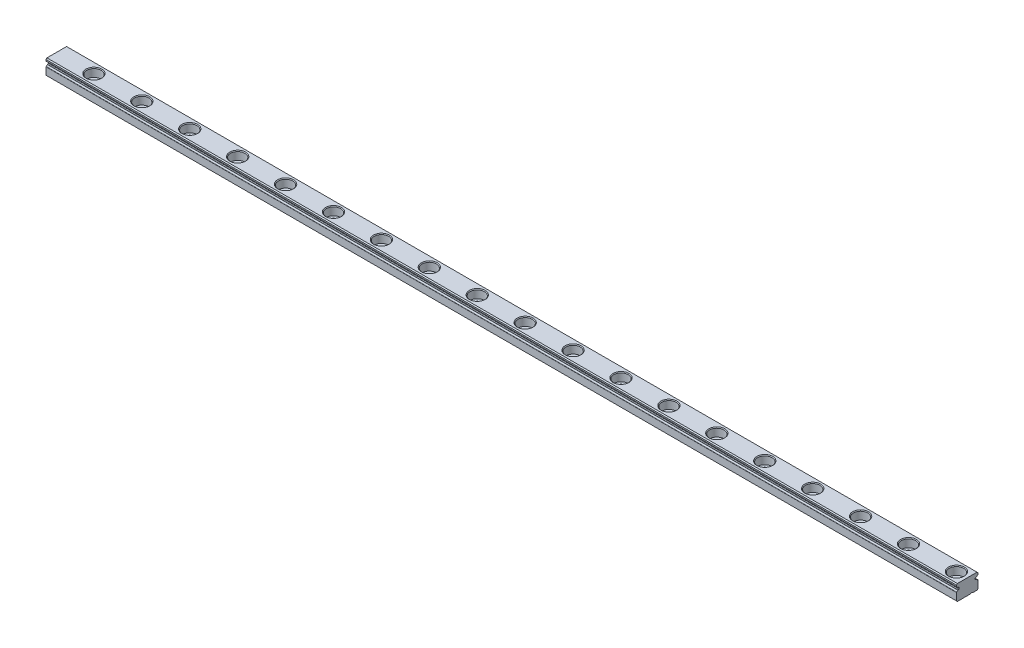
from build123d import *

# Parameters (mm, degrees)
EXTRUDE_1_DEPTH            = 190
PATTERN_LINEAR_1_COUNT     = 11
PATTERN_LINEAR_1_PITCH     = 20
PATTERN_LINEAR_1_COL_COUNT = 9
PATTERN_LINEAR_1_COL_PITCH = 20


with BuildPart() as part:
    # 草图1 → 凸台-拉伸1 (new, symmetric)
    with BuildSketch(Plane(origin=(0, 0, 0), x_dir=(0, 0, -1), z_dir=(1, 0, 0))):
        with BuildLine():
            Line((-4.5, 6.099989694), (-4.5, 5.5583))
            ThreePointArc((-4.5, 5.5583), (-4.475010695, 5.475400506), (-4.408368985, 5.420122355))
            ThreePointArc((-4.408368985, 5.420122355), (-4.141124334, 5.252255308), (-3.93950231, 5.009464023))
            ThreePointArc((-3.93950231, 5.009464023), (-3.898814145, 4.964704671), (-3.843755349, 4.939655613))
            Line((-3.843755349, 4.939655613), (-3.466644651, 4.853644387))
            ThreePointArc((-3.466644651, 4.853644387), (-3.382732565, 4.800932608), (-3.35, 4.7074))
            Line((-3.35, 4.7074), (-3.35, 4.2926))
            ThreePointArc((-3.35, 4.2926), (-3.382732565, 4.199067392), (-3.466644651, 4.146355613))
            Line((-3.466644651, 4.146355613), (-3.843755349, 4.060344387))
            ThreePointArc((-3.843755349, 4.060344387), (-3.898814145, 4.035295329), (-3.93950231, 3.990535977))
            ThreePointArc((-3.93950231, 3.990535977), (-4.141123452, 3.74774336), (-4.408368985, 3.579877645))
            ThreePointArc((-4.408368985, 3.579877645), (-4.475010695, 3.524599494), (-4.5, 3.4417))
            Line((-4.5, 3.4417), (-4.5, 0.400010306))
            Line((-4.5, 0.400010306), (-4.099989694, 0))
            Line((-4.099989694, 0), (1.4, 0))
            ThreePointArc((1.4, 0), (1.8, 0.2), (2.2, 0))
            Line((2.2, 0), (4.099989694, 0))
            Line((4.099989694, 0), (4.5, 0.400010306))
            Line((4.5, 0.400010306), (4.5, 3.4417))
            ThreePointArc((4.5, 3.4417), (4.475010695, 3.524599494), (4.408368985, 3.579877645))
            ThreePointArc((4.408368985, 3.579877645), (4.141124334, 3.747744692), (3.93950231, 3.990535977))
            ThreePointArc((3.93950231, 3.990535977), (3.898814145, 4.035295329), (3.843755349, 4.060344387))
            Line((3.843755349, 4.060344387), (3.466644651, 4.146355613))
            ThreePointArc((3.466644651, 4.146355613), (3.382732565, 4.199067392), (3.35, 4.2926))
            Line((3.35, 4.2926), (3.35, 4.7074))
            ThreePointArc((3.35, 4.7074), (3.382732565, 4.800932608), (3.466644651, 4.853644387))
            Line((3.466644651, 4.853644387), (3.843755349, 4.939655613))
            ThreePointArc((3.843755349, 4.939655613), (3.898814145, 4.964704671), (3.93950231, 5.009464023))
            ThreePointArc((3.93950231, 5.009464023), (4.141123452, 5.25225664), (4.408368985, 5.420122355))
            ThreePointArc((4.408368985, 5.420122355), (4.475010695, 5.475400506), (4.5, 5.5583))
            Line((4.5, 5.5583), (4.5, 6.099989694))
            Line((4.5, 6.099989694), (4.099989694, 6.5))
            Line((4.099989694, 6.5), (-4.099989694, 6.5))
            Line((-4.099989694, 6.5), (-4.5, 6.099989694))
        make_face()
    extrude(amount=EXTRUDE_1_DEPTH, both=True)

    # 草图2 → 切除-旋转1 (revolve, cut)
    with BuildSketch(Plane.XY, mode=Mode.PRIVATE) as cut_revolve_1_sk:
        Polygon((-14.5, 6.5), (-11.2, 6.5), (-11.5, 6.2), (-11.5, 3), (-12.75, 3), (-12.75, 0.3), (-12.45, 0), (-14.5, 0), align=None)
    cut_revolve_1 = revolve(cut_revolve_1_sk.sketch.rotate(Axis((-14.5, 0, 0), (0, 1, 0)), 270), axis=Axis((-14.5, 0, 0), (0, 1, 0)), mode=Mode.SUBTRACT)

    # 阵列(线性)1: 切除-旋转1 ×11
    with Locations(*[(i * PATTERN_LINEAR_1_PITCH, 0, 0) for i in range(1, PATTERN_LINEAR_1_COUNT)]):
        add(cut_revolve_1, mode=Mode.SUBTRACT)

    # 阵列(线性)1 col: 切除-旋转1 ×9
    with Locations(*[(-i * PATTERN_LINEAR_1_COL_PITCH, 0, 0) for i in range(1, PATTERN_LINEAR_1_COL_COUNT)]):
        add(cut_revolve_1, mode=Mode.SUBTRACT)


solid = part.part
